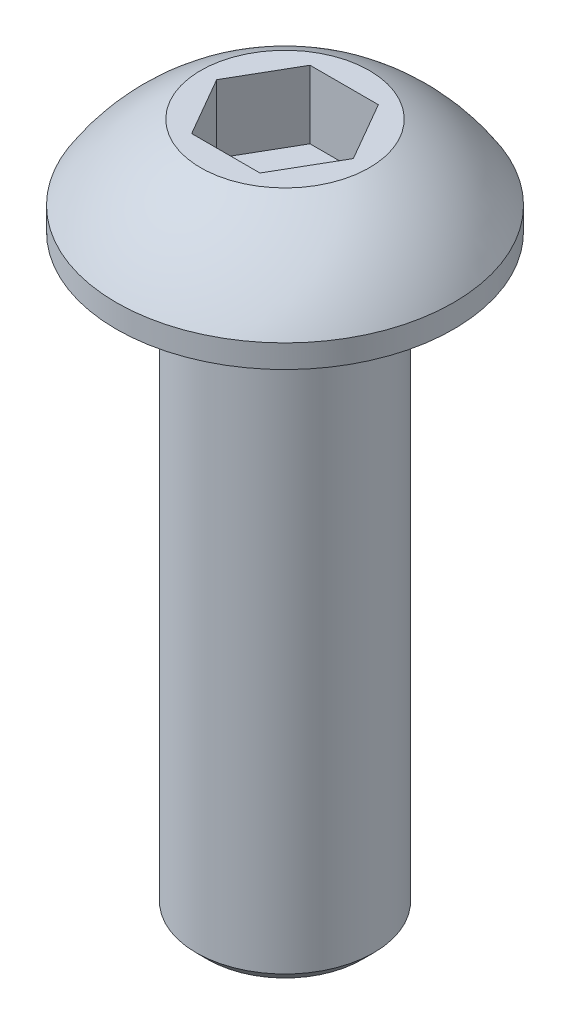
from build123d import *

# Parameters (mm, degrees)
CUT_EXTRUDE1_DEPTH = 1.15


with BuildPart() as part:
    # Sketch1 → Revolve1 (revolve)
    with BuildSketch(Plane(origin=(0, 0, 0), x_dir=(0, 0, -1), z_dir=(1, 0, 0)), mode=Mode.PRIVATE) as revolve1_sk:
        with BuildLine():
            Line((0, 1.65), (0, -10))
            Line((0, -10), (1.3, -10))
            Line((1.3, -10), (1.5, -9.8))
            Line((1.5, -9.8), (1.5, -0.2))
            ThreePointArc((1.5, -0.2), (1.558578644, -0.058578644), (1.7, 0))
            Line((1.7, 0), (2.85, 0))
            Line((2.85, 0), (2.85, 0.39))
            ThreePointArc((2.85, 0.39), (2.228408905, 1.122813643), (1.425, 1.65))
            Line((1.425, 1.65), (0, 1.65))
        make_face()
    revolve(revolve1_sk.sketch.rotate(Axis((0, 10.457062495, 0), (0, -1, 0)), 180), axis=Axis((0, 10.457062495, 0), (0, -1, 0)))

    # Sketch2 → Cut-Extrude1 (cut)
    with BuildSketch(Plane(origin=(0, 1.65, 0), x_dir=(1, 0, 0), z_dir=(0, 1, 0))):
        Polygon((0.577350269, -1), (1.154700538, 0), (0.577350269, 1), (-0.577350269, 1), (-1.154700538, 0), (-0.577350269, -1), align=None)
    extrude(amount=-CUT_EXTRUDE1_DEPTH, mode=Mode.SUBTRACT)


solid = part.part
